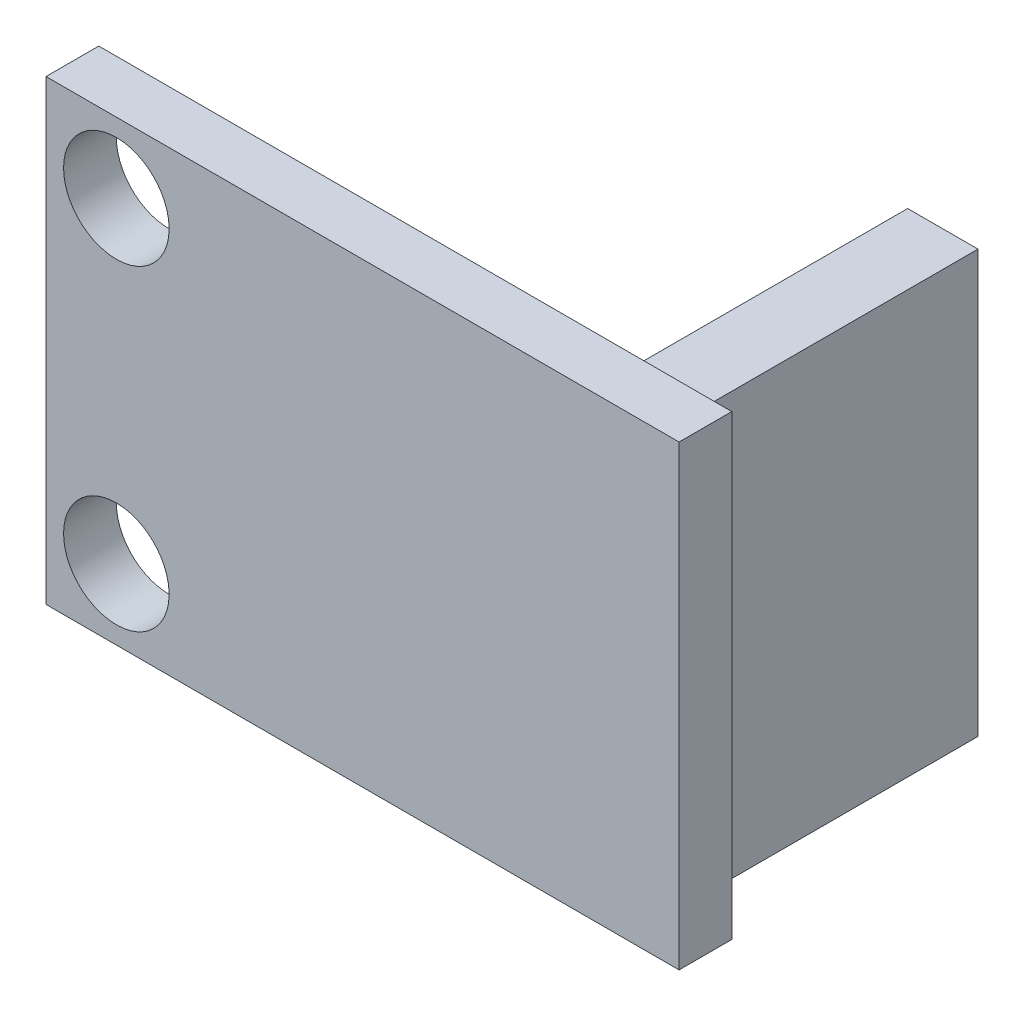
from build123d import *

# Parameters (mm, degrees)
ESQUISSE1_W             = 18
ESQUISSE1_H             = 13
BOSS_EXTRU_1_DEPTH      = 1.5
ENL_V_MAT_EXTRU_1_REACH = 13.203
ESQUISSE2_R             = 1.5
ESQUISSE3_W             = 2
ESQUISSE3_H             = 12
BOSS_EXTRU_2_DEPTH      = 8
ESQUISSE4_W             = 3
ESQUISSE4_H             = 3
BOSS_EXTRU_3_DEPTH      = 1


with BuildPart() as part:
    # Esquisse1 → Boss.-Extru.1 (new body)
    with BuildSketch(Plane.XY):
        Rectangle(ESQUISSE1_W, ESQUISSE1_H)
    extrude(amount=BOSS_EXTRU_1_DEPTH)

    # Esquisse2 → Enlèv. mat.-Extru.1 (cut, up to next)
    with BuildSketch(Plane(origin=(0, 0, 0), x_dir=(-1, 0, 0), z_dir=(0, 0, -1)), mode=Mode.PRIVATE) as enl_v_mat_extru_1_sk1:
        with Locations((7, 4.5)):
            Circle(ESQUISSE2_R)
    enl_v_mat_extru_1_tool1 = extrude(enl_v_mat_extru_1_sk1.sketch, amount=-ENL_V_MAT_EXTRU_1_REACH, mode=Mode.PRIVATE) & part.part
    enl_v_mat_extru_1 = enl_v_mat_extru_1_tool1.solids().sort_by_distance((-7, 4.5, 0))[0]
    add(enl_v_mat_extru_1, mode=Mode.SUBTRACT)

    # Symétrie1: Enlèv. mat.-Extru.1 across plane
    add(enl_v_mat_extru_1.mirror(Plane.ZX), mode=Mode.SUBTRACT)

    # Esquisse3 → Boss.-Extru.2 (add)
    with BuildSketch(Plane(origin=(0, 0, 0), x_dir=(-1, 0, 0), z_dir=(0, 0, -1))):
        with Locations((-7, 0)):
            Rectangle(ESQUISSE3_W, ESQUISSE3_H)
    extrude(amount=BOSS_EXTRU_2_DEPTH)

    # Esquisse4 → Boss.-Extru.3 (add)
    with BuildSketch(Plane(origin=(0, 0, 0), x_dir=(-1, 0, 0), z_dir=(0, 0, -1))):
        with Locations((0.5, 0)):
            Rectangle(ESQUISSE4_W, ESQUISSE4_H)
    extrude(amount=BOSS_EXTRU_3_DEPTH)


solid = part.part
